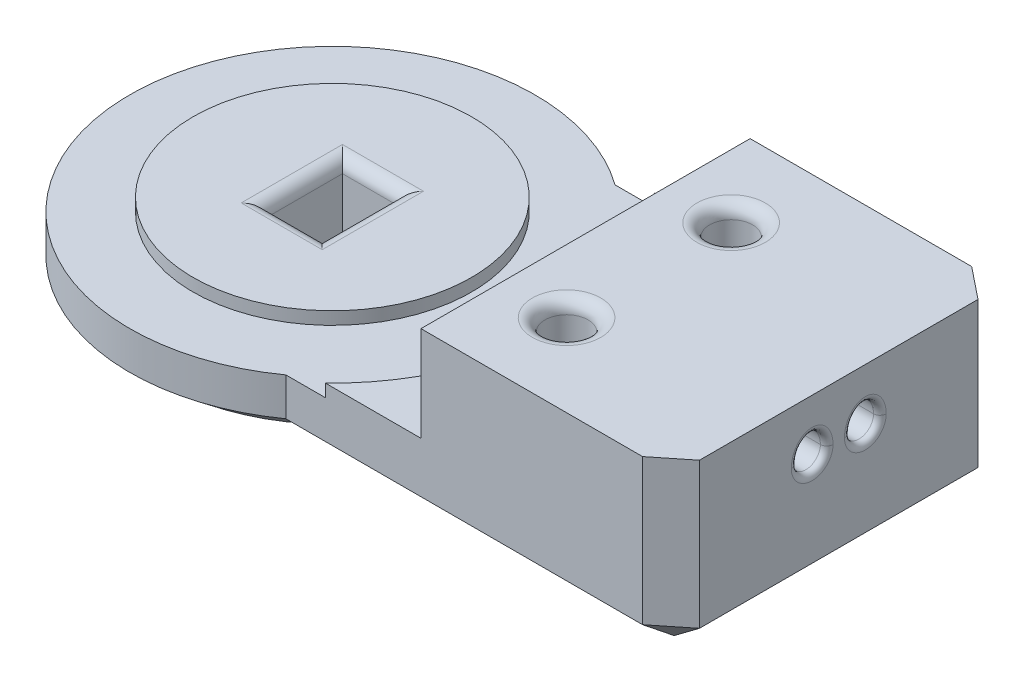
from build123d import *
from OCP.BRepFilletAPI import BRepFilletAPI_MakeChamfer

# Parameters (mm, degrees)
BOSS_EXTRUDE1_DEPTH     = 3
SKETCH2_R               = 9
SKETCH2_R_2             = 5.5
CUT_EXTRUDE1_DEPTH      = 0.5
SKETCH3_W               = 5
SKETCH3_H               = 13
BOSS_EXTRUDE2_DEPTH     = 3.75
CUT_EXTRUDE2_DEPTH      = 19.291049724
CUT_EXTRUDE2_DEPTH_BACK = 19.291049724
SKETCH4_R               = 0.85
SKETCH5_W               = 5
SKETCH5_H               = 13
BOSS_EXTRUDE3_DEPTH     = 6.75
CHAMFER1_SIZE           = 1
CHAMFER1_SIZE2          = 1.25
FILLET1_R               = 0.5
CUT_EXTRUDE3_DEPTH      = 21.051496204
FILLET2_R               = 0.25


with BuildPart() as part:
    # Sketch1 → Boss-Extrude1 (new body)
    with BuildSketch(Plane(origin=(0, 0, 0), x_dir=(1, 0, 0), z_dir=(0, 1, 0))):
        with BuildLine():
            Line((15, 6.5), (4.663689527, 6.5))
            ThreePointArc((4.663689527, 6.5), (-8, 0), (4.663689527, -6.5))
            Line((4.663689527, -6.5), (15, -6.5))
            Line((15, -6.5), (15, 6.5))
        make_face()
        Polygon((-1.1, -1.019803903), (-1.1, 1.019803903), (-1.1, 1.5), (1.1, 1.5), (1.1, 1.019803903), (1.1, -1.019803903), (1.1, -1.5), (-1.1, -1.5), align=None, mode=Mode.SUBTRACT)
    extrude(amount=-BOSS_EXTRUDE1_DEPTH)

    # Sketch2 → Cut-Extrude1 (cut)
    with BuildSketch(Plane(origin=(0, 0, 0), x_dir=(1, 0, 0), z_dir=(0, 1, 0))):
        Circle(SKETCH2_R)
        with Locations(Location((0, 0, 0), (0, 0, 180))):
            Circle(SKETCH2_R_2, mode=Mode.SUBTRACT)
    extrude(amount=-CUT_EXTRUDE1_DEPTH, mode=Mode.SUBTRACT)

    # Sketch3 → Boss-Extrude2 (add)
    with BuildSketch(Plane(origin=(0, 0, 0), x_dir=(1, 0, 0), z_dir=(0, 1, 0))):
        with Locations((12.5, 0)):
            Rectangle(SKETCH3_W, SKETCH3_H)
    extrude(amount=BOSS_EXTRUDE2_DEPTH)

    # Sketch4 → Cut-Extrude2 (cut, two sides: drawn at the far end of the back side and taken through both)
    with BuildSketch(Plane.XZ.offset(3).offset(-CUT_EXTRUDE2_DEPTH_BACK)):
        with Locations((12.5, 3.25)):
            Circle(SKETCH4_R)
        with Locations((12.5, -3.25)):
            Circle(SKETCH4_R)
    extrude(amount=CUT_EXTRUDE2_DEPTH + CUT_EXTRUDE2_DEPTH_BACK, mode=Mode.SUBTRACT)

    # Sketch5 → Boss-Extrude3 (add)
    with BuildSketch(Plane.XZ.offset(3)):
        with Locations((17.5, 0)):
            Rectangle(SKETCH5_W, SKETCH5_H)
    extrude(amount=-BOSS_EXTRUDE3_DEPTH)

    # Chamfer1: one chamfer whose edges measure the first distance from different faces: ONE call of the kernel's chamfer builder (chamfer() names one face for all edges)
    chamfer1_edges_1 = [part.edges().sort_by_distance(p)[0] for p in [
        (12.331844763, -3, -6.5),
    ]]
    chamfer1_side_1 = [part.faces().sort_by_distance(p)[0] for p in [
        (13.606286876, 0.018062264, -6.5),
    ]]
    chamfer1_edges_2 = [part.edges().sort_by_distance(p)[0] for p in [
        (-8, -3, 0),
    ]]
    chamfer1_side_2 = [part.faces().sort_by_distance(p)[0] for p in [
        (-8, -1.75, 0),
    ]]
    chamfer1_edges_3 = [part.edges().sort_by_distance(p)[0] for p in [
        (12.331844763, -3, 6.5),
    ]]
    chamfer1_side_3 = [part.faces().sort_by_distance(p)[0] for p in [
        (13.606286876, 0.018062264, 6.5),
    ]]
    chamfer1_edges_4 = [part.edges().sort_by_distance(p)[0] for p in [
        (20, 0.375, 6.5),
        (20, 0.375, -6.5),
        (20, -3, 0),
    ]]
    chamfer1_side_4 = [part.faces().sort_by_distance(p)[0] for p in [
        (20, 0.375, 0),
    ]]
    chamfer1 = BRepFilletAPI_MakeChamfer(part.part.solid().wrapped)
    for e in chamfer1_edges_1:
        chamfer1.Add(CHAMFER1_SIZE, CHAMFER1_SIZE2, e.wrapped, chamfer1_side_1[0].wrapped)  # the first distance lies on this face
    for e in chamfer1_edges_2:
        chamfer1.Add(CHAMFER1_SIZE, CHAMFER1_SIZE2, e.wrapped, chamfer1_side_2[0].wrapped)  # the first distance lies on this face
    for e in chamfer1_edges_3:
        chamfer1.Add(CHAMFER1_SIZE, CHAMFER1_SIZE2, e.wrapped, chamfer1_side_3[0].wrapped)  # the first distance lies on this face
    for e in chamfer1_edges_4:
        chamfer1.Add(CHAMFER1_SIZE, CHAMFER1_SIZE2, e.wrapped, chamfer1_side_4[0].wrapped)  # the first distance lies on this face
    add(Compound.cast(chamfer1.Shape()), mode=Mode.REPLACE)

    # Fillet1
    fillet1_edges = [part.edges().sort_by_distance(p)[0] for p in [
        (1.1, -3, 0),
        (-1.1, 0, 0),
        (0, 0, 1.5),
        (1.1, 0, 0),
        (0, 0, -1.5),
        (0, -3, 1.5),
        (-1.1, -3, 0),
        (11.65, 3.75, 3.25),
        (11.65, -3, 3.25),
        (11.65, 3.75, -3.25),
        (11.65, -3, -3.25),
        (0, -3, -1.5),
    ]]
    fillet(fillet1_edges, radius=FILLET1_R)

    # Sketch6 → Cut-Extrude3 (cut, through all)
    with BuildSketch(Plane.ZY.offset(-10)):
        with BuildLine():
            ThreePointArc((0.475, 1.65), (1.05, 1.075), (1.625, 1.65))
            add(Edge.make_bspline(
                [(1.625, 1.65), (1.625, 2.4), (1.05, 2.4), (0.475, 2.4), (0.475, 1.65)],
                knots=[4.71238898, 4.71238898, 4.71238898, 6.283185307, 6.283185307, 7.853981634, 7.853981634, 7.853981634], degree=2, weights=[1, 0.707106781, 1, 0.707106781, 1]))
        make_face()
        with BuildLine():
            ThreePointArc((-1.625, 1.65), (-1.05, 1.075), (-0.475, 1.65))
            add(Edge.make_bspline(
                [(-0.475, 1.65), (-0.475, 2.4), (-1.05, 2.4), (-1.625, 2.4), (-1.625, 1.65)],
                knots=[4.71238898, 4.71238898, 4.71238898, 6.283185307, 6.283185307, 7.853981634, 7.853981634, 7.853981634], degree=2, weights=[1, 0.707106781, 1, 0.707106781, 1]))
        make_face()
    extrude(amount=-CUT_EXTRUDE3_DEPTH, mode=Mode.SUBTRACT)

    # Fillet2
    fillet2_edges = [part.edges().sort_by_distance(p)[0] for p in [
        (20, 2.4, -1.05),
        (20, 1.075, -1.05),
        (10, 2.4, -1.05),
        (10, 1.075, -1.05),
        (20, 2.4, 1.05),
        (20, 1.075, 1.05),
        (10, 2.4, 1.05),
        (10, 1.075, 1.05),
    ]]
    fillet(fillet2_edges, radius=FILLET2_R)


solid = part.part
